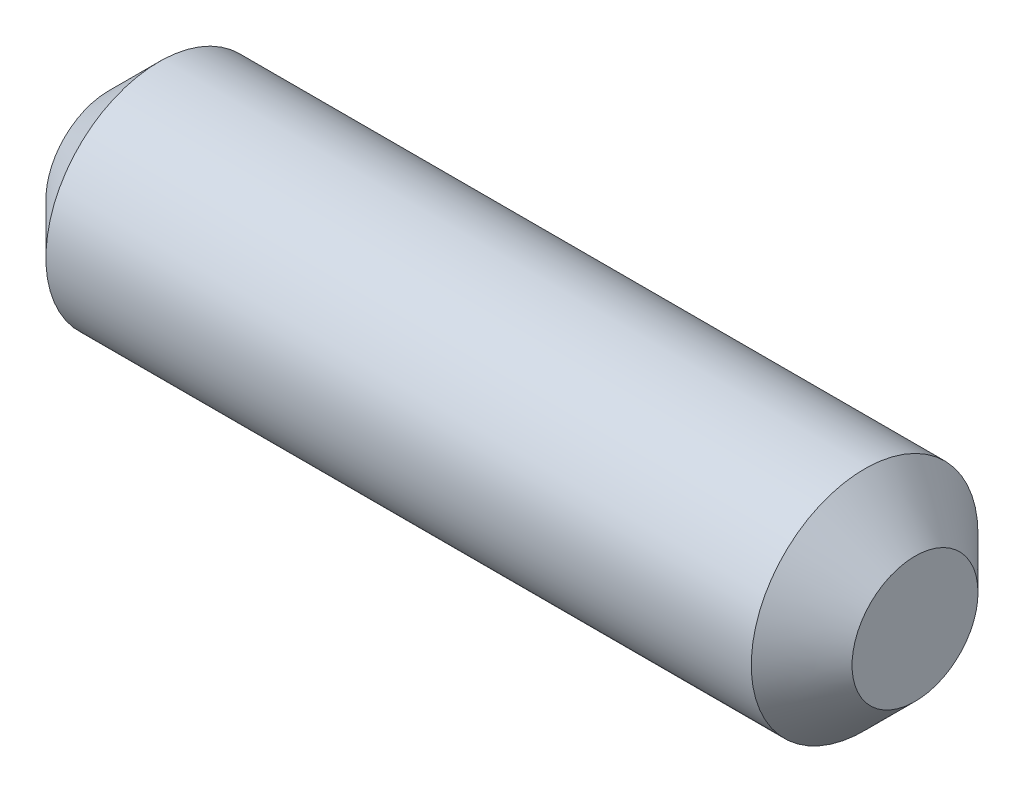
from build123d import *

# Parameters (mm, degrees)
SWEEP1_PROFILE_R = 2.25
CHAMFER1_SIZE    = 1
SCALE1_SCALE     = 0.8


with BuildPart() as part:
    # Sweep1: sweep along a path in Sketch1
    with BuildLine(Plane.XY) as sweep1_path:
        Line((0, 0), (16, 0))
    # Sweep1 profile (on start of the path) → Sweep1 (sweep)
    with BuildSketch(Plane(origin=(0, 0, 0), x_dir=(0, 0, 1), z_dir=(1, 0, 0))):
        Circle(SWEEP1_PROFILE_R)
    sweep(path=sweep1_path.line)

    # Chamfer1
    chamfer1_edges = [part.edges().sort_by_distance(p)[0] for p in [
        (0, 0, -2.25),
        (16, 0, -2.25),
    ]]
    chamfer(chamfer1_edges, length=CHAMFER1_SIZE)


with BuildPart() as part_1:
    # Scale1: scaled about (8, 0, 0)
    add(part.part.scale(SCALE1_SCALE).moved(Location((1.6, 0, 0))))


solid = part_1.part
